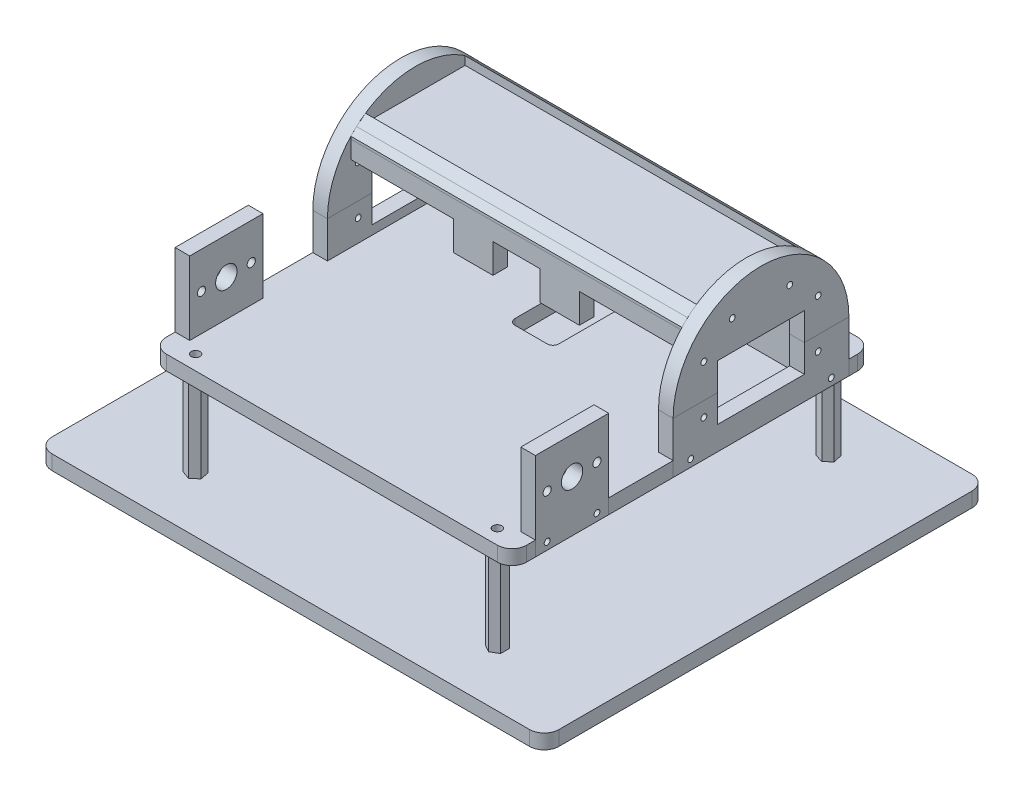
from build123d import *

# Parameters (mm, degrees)
RESSALTO_EXTRUS_O1_DEPTH        = 5
ESBO_O2_W                       = 5
ESBO_O2_H                       = 25
CORTE_EXTRUS_O1_DEPTH           = 5
RESSALTO_EXTRUS_O2_DEPTH        = 25
RESSALTO_EXTRUS_O2_DEPTH_BACK   = 5
ESBO_O4_W                       = 5
ESBO_O4_H                       = 25
RESSALTO_EXTRUS_O2_2_DEPTH      = 25
RESSALTO_EXTRUS_O2_2_DEPTH_BACK = 5
ESBO_O5_R                       = 1
ESBO_O5_R_2                     = 3.65
ESBO_O5_R_3                     = 1.4
CORTE_EXTRUS_O2_DEPTH           = 5
ESBO_O6_R                       = 1
ESBO_O6_R_2                     = 3.65
ESBO_O6_R_3                     = 1.4
CORTE_EXTRUS_O3_DEPTH           = 5
ESBO_O7_W                       = 5
ESBO_O7_H                       = 60
CORTE_EXTRUS_O4_DEPTH           = 5
RESSALTO_EXTRUS_O3_DEPTH        = 12.5
RESSALTO_EXTRUS_O3_DEPTH_BACK   = 5
ESBO_O8_W                       = 5
ESBO_O8_H                       = 60
RESSALTO_EXTRUS_O3_2_DEPTH      = 12.5
RESSALTO_EXTRUS_O3_2_DEPTH_BACK = 5
RESSALTO_EXTRUS_O4_DEPTH        = 5
RESSALTO_EXTRUS_O5_DEPTH        = 5
ESBO_O11_W                      = 29.591
ESBO_O11_H                      = 18.85
CORTE_EXTRUS_O5_DEPTH           = 5
ESBO_O17_W                      = 113
ESBO_O17_H                      = 5
RESSALTO_EXTRUS_O7_DEPTH        = 32
ESBO_O22_W                      = 113
ESBO_O22_H                      = 5
RESSALTO_EXTRUS_O10_DEPTH       = 32
ESBO_O23_W                      = 34
ESBO_O23_H                      = 5
RESSALTO_EXTRUS_O11_DEPTH       = 113
RESSALTO_EXTRUS_O12_DEPTH       = 113
RESSALTO_EXTRUS_O12_2_DEPTH     = 113
CORTE_EXTRUS_O7_DEPTH           = 39
CORTE_EXTRUS_O7_DEPTH_BACK      = 5
ESBO_O25_W                      = 35
ESBO_O25_H                      = 10
CORTE_EXTRUS_O8_DEPTH           = 39
CORTE_EXTRUS_O8_DEPTH_BACK      = 5
ESBO_O26_W                      = 35
ESBO_O26_H                      = 10
ESBO_O27_W                      = 29.6
ESBO_O27_H                      = 18.85
CORTE_EXTRUS_O9_DEPTH           = 5
ESBO_O28_R                      = 1
CORTE_EXTRUS_O10_DEPTH          = 5
ESBO_O29_R                      = 1
CORTE_EXTRUS_O11_DEPTH          = 5
ESBO_O31_R                      = 1.6255
CORTE_EXTRUS_O12_DEPTH          = 10
CORTE_EXTRUS_O13_DEPTH          = 5
ESBO_O33_W                      = 16
ESBO_O33_H                      = 10
CORTE_EXTRUS_O14_DEPTH          = 5
RESSALTO_EXTRUS_O13_DEPTH       = 30
RESSALTO_EXTRUS_O13_2_DEPTH     = 30
RESSALTO_EXTRUS_O13_3_DEPTH     = 30
RESSALTO_EXTRUS_O13_4_DEPTH     = 30
ESBO_O35_R                      = 1.5
RESSALTO_EXTRUS_O14_DEPTH       = 6
RESSALTO_EXTRUS_O14_2_DEPTH     = 6
RESSALTO_EXTRUS_O14_3_DEPTH     = 6
RESSALTO_EXTRUS_O14_4_DEPTH     = 6
ESBO_O36_R                      = 1.5
CORTE_EXTRUS_O15_DEPTH          = 10
RESSALTO_EXTRUS_O15_DEPTH       = 5
ESBO_O40_W                      = 113
ESBO_O40_H                      = 16
CORTE_EXTRUS_O16_DEPTH          = 5


with BuildPart() as part:
    # Esboço1 → Ressalto-extrusão1 (new body)
    with BuildSketch(Plane(origin=(0, 0, 0), x_dir=(1, 0, 0), z_dir=(0, 1, 0))):
        with BuildLine():
            Line((-20.688948469, 116.486662709), (92.311051531, 116.486662709))
            ThreePointArc((92.311051531, 116.486662709), (95.846585437, 115.022196615), (97.311051531, 111.486662709))
            Line((97.311051531, 111.486662709), (97.311051531, -1.513337291))
            ThreePointArc((97.311051531, -1.513337291), (95.846585437, -5.048871197), (92.311051531, -6.513337291))
            Line((92.311051531, -6.513337291), (-20.688948469, -6.513337291))
            ThreePointArc((-20.688948469, -6.513337291), (-24.224482375, -5.048871197), (-25.688948469, -1.513337291))
            Line((-25.688948469, -1.513337291), (-25.688948469, 111.486662709))
            ThreePointArc((-25.688948469, 111.486662709), (-24.224482375, 115.022196615), (-20.688948469, 116.486662709))
        make_face()
    extrude(amount=RESSALTO_EXTRUS_O1_DEPTH)

    # Esboço2 → Corte-extrusão1 (cut)
    with BuildSketch(Plane(origin=(0, 5, 0), x_dir=(1, 0, 0), z_dir=(0, 1, 0))):
        with Locations((94.811051531, 13.986662709)):
            Rectangle(ESBO_O2_W, ESBO_O2_H)
        with Locations((-23.188948469, 13.986662709)):
            Rectangle(ESBO_O2_W, ESBO_O2_H)
    extrude(amount=-CORTE_EXTRUS_O1_DEPTH, mode=Mode.SUBTRACT)

    # Esboço7 → Corte-extrusão4 (cut)
    with BuildSketch(Plane(origin=(0, 5, 0), x_dir=(1, 0, 0), z_dir=(0, 1, 0))):
        with Locations((94.811051531, 78.486662709)):
            Rectangle(ESBO_O7_W, ESBO_O7_H)
        with Locations((-23.188948469, 78.486662709)):
            Rectangle(ESBO_O7_W, ESBO_O7_H)
    extrude(amount=-CORTE_EXTRUS_O4_DEPTH, mode=Mode.SUBTRACT)

    # Esboço32 → Corte-extrusão13 (cut)
    with BuildSketch(Plane.XZ):
        with BuildLine():
            Line((30.311051531, -111.486662709), (41.311051531, -111.486662709))
            ThreePointArc((41.311051531, -111.486662709), (42.725265093, -110.900876271), (43.311051531, -109.486662709))
            Line((43.311051531, -109.486662709), (43.311051531, -63.486662709))
            ThreePointArc((43.311051531, -63.486662709), (42.725265093, -62.072449147), (41.311051531, -61.486662709))
            Line((41.311051531, -61.486662709), (30.311051531, -61.486662709))
            ThreePointArc((30.311051531, -61.486662709), (28.896837969, -62.072449147), (28.311051531, -63.486662709))
            Line((28.311051531, -63.486662709), (28.311051531, -109.486662709))
            ThreePointArc((28.311051531, -109.486662709), (28.896837969, -110.900876271), (30.311051531, -111.486662709))
        make_face()
    extrude(amount=-CORTE_EXTRUS_O13_DEPTH, mode=Mode.SUBTRACT)


with BuildPart() as body_2:
    # Esboço4 → Ressalto-extrusão2 (new, two sides: drawn at the far end of the back side and taken through both)
    with BuildSketch(Plane(origin=(0, 5, 0), x_dir=(1, 0, 0), z_dir=(0, 1, 0)).offset(-RESSALTO_EXTRUS_O2_DEPTH_BACK)):
        with Locations((94.811051531, 13.986662709)):
            Rectangle(ESBO_O4_W, ESBO_O4_H)
    extrude(amount=RESSALTO_EXTRUS_O2_DEPTH + RESSALTO_EXTRUS_O2_DEPTH_BACK)

    # Esboço5 → Corte-extrusão2 (cut)
    with BuildSketch(Plane(origin=(97.311051531, 0, 0), x_dir=(0, 0, -1), z_dir=(1, 0, 0))):
        with Locations((5.486662709, 2.5)):
            Circle(ESBO_O5_R)
        with Locations((22.486662709, 2.5)):
            Circle(ESBO_O5_R)
        with Locations((13.986662709, 17.5)):
            Circle(ESBO_O5_R_2)
        with Locations((5.486662709, 17.5)):
            Circle(ESBO_O5_R_3)
        with Locations((22.486662709, 17.5)):
            Circle(ESBO_O5_R_3)
    extrude(amount=-CORTE_EXTRUS_O2_DEPTH, mode=Mode.SUBTRACT)


with BuildPart() as body_3:
    # Esboço4 → Ressalto-extrus_o2 2 (new, two sides: drawn at the far end of the back side and taken through both)
    with BuildSketch(Plane(origin=(0, 5, 0), x_dir=(1, 0, 0), z_dir=(0, 1, 0)).offset(-RESSALTO_EXTRUS_O2_2_DEPTH_BACK)):
        with Locations((-23.188948469, 13.986662709)):
            Rectangle(ESBO_O4_W, ESBO_O4_H)
    extrude(amount=RESSALTO_EXTRUS_O2_2_DEPTH + RESSALTO_EXTRUS_O2_2_DEPTH_BACK)

    # Esboço6 → Corte-extrusão3 (cut)
    with BuildSketch(Plane.ZY.offset(25.688948469)):
        with Locations((-22.486662709, 2.5)):
            Circle(ESBO_O6_R)
        with Locations((-5.486662709, 2.5)):
            Circle(ESBO_O6_R)
        with Locations((-13.986662709, 17.5)):
            Circle(ESBO_O6_R_2)
        with Locations((-5.486662709, 17.5)):
            Circle(ESBO_O6_R_3)
        with Locations((-22.486662709, 17.5)):
            Circle(ESBO_O6_R_3)
    extrude(amount=-CORTE_EXTRUS_O3_DEPTH, mode=Mode.SUBTRACT)


with BuildPart() as body_4:
    # Esboço8 → Ressalto-extrusão3 (new, two sides: drawn at the far end of the back side and taken through both)
    with BuildSketch(Plane(origin=(0, 5, 0), x_dir=(1, 0, 0), z_dir=(0, 1, 0)).offset(-RESSALTO_EXTRUS_O3_DEPTH_BACK)):
        with Locations((94.811051531, 78.486662709)):
            Rectangle(ESBO_O8_W, ESBO_O8_H)
    extrude(amount=RESSALTO_EXTRUS_O3_DEPTH + RESSALTO_EXTRUS_O3_DEPTH_BACK)


with BuildPart() as body_5:
    # Esboço8 → Ressalto-extrus_o3 2 (new, two sides: drawn at the far end of the back side and taken through both)
    with BuildSketch(Plane(origin=(0, 5, 0), x_dir=(1, 0, 0), z_dir=(0, 1, 0)).offset(-RESSALTO_EXTRUS_O3_2_DEPTH_BACK)):
        with Locations((-23.188948469, 78.486662709)):
            Rectangle(ESBO_O8_W, ESBO_O8_H)
    extrude(amount=RESSALTO_EXTRUS_O3_2_DEPTH + RESSALTO_EXTRUS_O3_2_DEPTH_BACK)


with BuildPart() as body_6:
    # Esboço9 → Ressalto-extrusão4 (new body)
    with BuildSketch(Plane(origin=(97.311051531, 0, 0), x_dir=(0, 0, -1), z_dir=(1, 0, 0))):
        with BuildLine():
            Line((108.486662709, 17.5), (48.486662709, 17.5))
            ThreePointArc((48.486662709, 17.5), (78.486662709, 47.5), (108.486662709, 17.5))
        make_face()
    extrude(amount=-RESSALTO_EXTRUS_O4_DEPTH)


with BuildPart() as body_7:
    # Esboço10 → Ressalto-extrusão5 (new body)
    with BuildSketch(Plane.ZY.offset(25.688948469)):
        with BuildLine():
            Line((-48.486662709, 17.5), (-108.486662709, 17.5))
            ThreePointArc((-108.486662709, 17.5), (-78.486662709, 47.5), (-48.486662709, 17.5))
        make_face()
    extrude(amount=-RESSALTO_EXTRUS_O5_DEPTH)


with BuildPart() as corte_extrus_o5_tool:
    # Esboço11 → Corte-extrusão5 (new body)
    with BuildSketch(Plane.ZY.offset(25.688948469)):
        with Locations((-78.486662709, 17.525)):
            Rectangle(ESBO_O11_W, ESBO_O11_H)
    extrude(amount=-CORTE_EXTRUS_O5_DEPTH)


with BuildPart() as body_5_1:
    add(body_5.part)

    # Corte-extrusão5: cut by corte_extrus_o5_tool
    add(corte_extrus_o5_tool.part, mode=Mode.SUBTRACT)


with BuildPart() as body_7_1:
    add(body_7.part)

    # Corte-extrusão5: cut by corte_extrus_o5_tool
    add(corte_extrus_o5_tool.part, mode=Mode.SUBTRACT)


with BuildPart() as body_8:
    # Esboço17 → Ressalto-extrusão7 (new body)
    with BuildSketch(Plane(origin=(0, 5, 0), x_dir=(1, 0, 0), z_dir=(0, 1, 0))):
        with Locations((35.811051531, 58.986662709)):
            Rectangle(ESBO_O17_W, ESBO_O17_H)
    extrude(amount=RESSALTO_EXTRUS_O7_DEPTH)


with BuildPart() as body_9:
    # Esboço22 → Ressalto-extrusão10 (new body)
    with BuildSketch(Plane(origin=(0, 5, 0), x_dir=(1, 0, 0), z_dir=(0, 1, 0))):
        with Locations((35.811051531, 97.986662709)):
            Rectangle(ESBO_O22_W, ESBO_O22_H)
    extrude(amount=RESSALTO_EXTRUS_O10_DEPTH)


with BuildPart() as body_10:
    # Esboço23 → Ressalto-extrusão11 (new body)
    with BuildSketch(Plane.ZY.offset(-92.311051531)):
        with Locations((-78.486662709, 36.82)):
            Rectangle(ESBO_O23_W, ESBO_O23_H)
    extrude(amount=RESSALTO_EXTRUS_O11_DEPTH)


with BuildPart() as body_11:
    # Esboço24 → Ressalto-extrusão12 (new body)
    with BuildSketch(Plane.ZY.offset(-92.311051531)):
        Polygon((-100.486662709, 37), (-100.486662709, 37.866564726), (-98.561575635, 39.793449061), (-96.117316959, 41.772618951), (-95.486662709, 42.17326521), (-95.486662709, 37), align=None)
    extrude(amount=RESSALTO_EXTRUS_O12_DEPTH)


with BuildPart() as body_12:
    # Esboço24 → Ressalto-extrus_o12 2 (new body)
    with BuildSketch(Plane.ZY.offset(-92.311051531)):
        Polygon((-56.486662709, 37), (-61.486662709, 37), (-61.486662709, 42.17326521), (-58.411749783, 39.793449061), (-56.486662709, 37.868361986), align=None)
    extrude(amount=RESSALTO_EXTRUS_O12_2_DEPTH)


with BuildPart() as corte_extrus_o7_tool:
    # Esboço25 → Corte-extrusão7 (new, two sides: drawn at the far end of the back side and taken through both)
    with BuildSketch(Plane(origin=(0, 0, -61.486662709), x_dir=(-1, 0, 0), z_dir=(0, 0, -1)).offset(-CORTE_EXTRUS_O7_DEPTH_BACK)):
        with Locations((3.188948469, 26)):
            Rectangle(ESBO_O25_W, ESBO_O25_H)
    extrude(amount=CORTE_EXTRUS_O7_DEPTH + CORTE_EXTRUS_O7_DEPTH_BACK)


with BuildPart() as body_8_1:
    add(body_8.part)

    # Corte-extrusão7: cut by corte_extrus_o7_tool
    add(corte_extrus_o7_tool.part, mode=Mode.SUBTRACT)


with BuildPart() as body_9_1:
    add(body_9.part)

    # Corte-extrusão7: cut by corte_extrus_o7_tool
    add(corte_extrus_o7_tool.part, mode=Mode.SUBTRACT)


with BuildPart() as corte_extrus_o8_tool:
    # Esboço26 → Corte-extrusão8 (new, two sides: drawn at the far end of the back side and taken through both)
    with BuildSketch(Plane(origin=(0, 0, -61.486662709), x_dir=(-1, 0, 0), z_dir=(0, 0, -1)).offset(-CORTE_EXTRUS_O8_DEPTH_BACK)):
        with Locations((-74.811051531, 26)):
            Rectangle(ESBO_O26_W, ESBO_O26_H)
    extrude(amount=CORTE_EXTRUS_O8_DEPTH + CORTE_EXTRUS_O8_DEPTH_BACK)


with BuildPart() as body_8_2:
    add(body_8_1.part)

    # Corte-extrusão8: cut by corte_extrus_o8_tool
    add(corte_extrus_o8_tool.part, mode=Mode.SUBTRACT)

    # Esboço33 → Corte-extrusão14 (cut)
    with BuildSketch(Plane.XY.offset(-56.486662709)):
        with Locations((35.811051531, 26)):
            Rectangle(ESBO_O33_W, ESBO_O33_H)
    extrude(amount=-CORTE_EXTRUS_O14_DEPTH, mode=Mode.SUBTRACT)

    # Esboço40 → Corte-extrusão16 (cut)
    with BuildSketch(Plane.XY.offset(-56.486662709)):
        with Locations((35.811051531, 13)):
            Rectangle(ESBO_O40_W, ESBO_O40_H)
    extrude(amount=-CORTE_EXTRUS_O16_DEPTH, mode=Mode.SUBTRACT)


with BuildPart() as body_9_2:
    add(body_9_1.part)

    # Corte-extrusão8: cut by corte_extrus_o8_tool
    add(corte_extrus_o8_tool.part, mode=Mode.SUBTRACT)

    # Esboço31 → Corte-extrusão12 (cut)
    with BuildSketch(Plane(origin=(0, 0, -100.486662709), x_dir=(-1, 0, 0), z_dir=(0, 0, -1))):
        with Locations((-17.141051531, 13)):
            Circle(ESBO_O31_R)
        with Locations((-54.481051531, 13)):
            Circle(ESBO_O31_R)
    extrude(amount=-CORTE_EXTRUS_O12_DEPTH, mode=Mode.SUBTRACT)


with BuildPart() as corte_extrus_o9_tool:
    # Esboço27 → Corte-extrusão9 (new body)
    with BuildSketch(Plane(origin=(97.311051531, 0, 0), x_dir=(0, 0, -1), z_dir=(1, 0, 0))):
        with Locations((78.486662709, 17.525)):
            Rectangle(ESBO_O27_W, ESBO_O27_H)
    extrude(amount=-CORTE_EXTRUS_O9_DEPTH)


with BuildPart() as body_4_1:
    add(body_4.part)

    # Corte-extrusão9: cut by corte_extrus_o9_tool
    add(corte_extrus_o9_tool.part, mode=Mode.SUBTRACT)


with BuildPart() as body_6_1:
    add(body_6.part)

    # Corte-extrusão9: cut by corte_extrus_o9_tool
    add(corte_extrus_o9_tool.part, mode=Mode.SUBTRACT)


with BuildPart() as corte_extrus_o10_tool:
    # Esboço28 → Corte-extrusão10 (new body)
    with BuildSketch(Plane.ZY.offset(25.688948469)):
        with Locations((-97.986662709, 12.5)):
            Circle(ESBO_O28_R)
        with Locations((-97.986662709, 29)):
            Circle(ESBO_O28_R)
        with Locations((-58.986662709, 29)):
            Circle(ESBO_O28_R)
        with Locations((-58.986662709, 12.5)):
            Circle(ESBO_O28_R)
        with Locations((-88.282162709, 37)):
            Circle(ESBO_O28_R)
        with Locations((-68.691162709, 37)):
            Circle(ESBO_O28_R)
        with Locations((-54.486662709, 2.5)):
            Circle(ESBO_O28_R)
        with Locations((-102.486662709, 2.5)):
            Circle(ESBO_O28_R)
    extrude(amount=-CORTE_EXTRUS_O10_DEPTH)


with BuildPart() as body_5_2:
    add(body_5_1.part)

    # Corte-extrusão10: cut by corte_extrus_o10_tool
    add(corte_extrus_o10_tool.part, mode=Mode.SUBTRACT)


with BuildPart() as body_7_2:
    add(body_7_1.part)

    # Corte-extrusão10: cut by corte_extrus_o10_tool
    add(corte_extrus_o10_tool.part, mode=Mode.SUBTRACT)


with BuildPart() as corte_extrus_o11_tool:
    # Esboço29 → Corte-extrusão11 (new body)
    with BuildSketch(Plane(origin=(97.311051531, 0, 0), x_dir=(0, 0, -1), z_dir=(1, 0, 0))):
        with Locations(Location((54.486662709, 2.5, 0), (0, 0, 180))):
            Circle(ESBO_O29_R)
        with Locations(Location((102.486662709, 2.5, 0), (0, 0, 180))):
            Circle(ESBO_O29_R)
        with Locations(Location((58.986662709, 12.5, 0), (0, 0, 180))):
            Circle(ESBO_O29_R)
        with Locations(Location((58.986662709, 29, 0), (0, 0, 180))):
            Circle(ESBO_O29_R)
        with Locations((68.686662709, 37)):
            Circle(ESBO_O29_R)
        with Locations((88.286662709, 37)):
            Circle(ESBO_O29_R)
        with Locations(Location((97.986662709, 29, 0), (0, 0, 180))):
            Circle(ESBO_O29_R)
        with Locations(Location((97.986662709, 12.5, 0), (0, 0, 180))):
            Circle(ESBO_O29_R)
    extrude(amount=-CORTE_EXTRUS_O11_DEPTH)


with BuildPart() as body_4_2:
    add(body_4_1.part)

    # Corte-extrusão11: cut by corte_extrus_o11_tool
    add(corte_extrus_o11_tool.part, mode=Mode.SUBTRACT)


with BuildPart() as body_6_2:
    add(body_6_1.part)

    # Corte-extrusão11: cut by corte_extrus_o11_tool
    add(corte_extrus_o11_tool.part, mode=Mode.SUBTRACT)


with BuildPart() as body_13:
    # Esboço34 → Ressalto-extrusão13 (new body)
    with BuildSketch(Plane.XZ):
        Polygon((87.311051531, 4.513337291), (84.71297532, 3.013337291), (84.71297532, 0.013337291), (87.311051531, -1.486662709), (89.909127742, 0.013337291), (89.909127742, 3.013337291), align=None)
    extrude(amount=RESSALTO_EXTRUS_O13_DEPTH)


with BuildPart() as body_14:
    # Esboço34 → Ressalto-extrus_o13 2 (new body)
    with BuildSketch(Plane.XZ):
        Polygon((-13.420554992, -0.449923017), (-12.85451843, 2.496193514), (-15.122911907, 4.459453821), (-17.957341945, 3.476597599), (-18.523378508, 0.530481068), (-16.254985031, -1.432779239), align=None)
    extrude(amount=RESSALTO_EXTRUS_O13_2_DEPTH)


with BuildPart() as body_15:
    # Esboço34 → Ressalto-extrus_o13 3 (new body)
    with BuildSketch(Plane.XZ):
        Polygon((87.969999913, -108.559926125), (85.10589749, -109.452628379), (84.446949109, -112.379364963), (86.65210315, -114.413399293), (89.516205572, -113.520697039), (90.175153954, -110.593960455), align=None)
    extrude(amount=RESSALTO_EXTRUS_O13_3_DEPTH)


with BuildPart() as body_16:
    # Esboço34 → Ressalto-extrus_o13 4 (new body)
    with BuildSketch(Plane.XZ):
        Polygon((-18.480554249, -110.388055788), (-18.036172861, -113.354960772), (-15.244567081, -114.453567693), (-12.897342688, -112.58526963), (-13.341724077, -109.618364646), (-16.133329857, -108.519757725), align=None)
    extrude(amount=RESSALTO_EXTRUS_O13_4_DEPTH)


with BuildPart() as body_17:
    # Esboço35 → Ressalto-extrusão14 (new body)
    with BuildSketch(Plane.XZ.offset(30)):
        with Locations(Location((87.278117348, -111.624182303, 0), (0, 0, 270))):
            Circle(ESBO_O35_R)
    extrude(amount=RESSALTO_EXTRUS_O14_DEPTH)


with BuildPart() as body_18:
    # Esboço35 → Ressalto-extrus_o14 2 (new body)
    with BuildSketch(Plane.XZ.offset(30)):
        with Locations(Location((-15.705941855, -111.624182303, 0), (0, 0, 270))):
            Circle(ESBO_O35_R)
    extrude(amount=RESSALTO_EXTRUS_O14_2_DEPTH)


with BuildPart() as body_19:
    # Esboço35 → Ressalto-extrus_o14 3 (new body)
    with BuildSketch(Plane.XZ.offset(30)):
        with Locations(Location((-15.705941855, 1.457424581, 0), (0, 0, 270))):
            Circle(ESBO_O35_R)
    extrude(amount=RESSALTO_EXTRUS_O14_3_DEPTH)


with BuildPart() as body_20:
    # Esboço35 → Ressalto-extrus_o14 4 (new body)
    with BuildSketch(Plane.XZ.offset(30)):
        with Locations(Location((87.278117348, 1.457424581, 0), (0, 0, 270))):
            Circle(ESBO_O35_R)
    extrude(amount=RESSALTO_EXTRUS_O14_4_DEPTH)


with BuildPart() as corte_extrus_o15_tool:
    # Esboço36 → Corte-extrusão15 (new body)
    with BuildSketch(Plane(origin=(0, 5, 0), x_dir=(1, 0, 0), z_dir=(0, 1, 0))):
        with Locations(Location((87.311051531, -1.513337291, 0), (0, 0, 270))):
            Circle(ESBO_O36_R)
        with Locations(Location((-15.688948469, -1.513337291, 0), (0, 0, 270))):
            Circle(ESBO_O36_R)
        with Locations(Location((-15.688948469, 111.486662709, 0), (0, 0, 270))):
            Circle(ESBO_O36_R)
        with Locations(Location((87.311051531, 111.486662709, 0), (0, 0, 270))):
            Circle(ESBO_O36_R)
    extrude(amount=-CORTE_EXTRUS_O15_DEPTH)


with BuildPart() as part_1:
    add(part.part)

    # Corte-extrusão15: cut by corte_extrus_o15_tool
    add(corte_extrus_o15_tool.part, mode=Mode.SUBTRACT)


with BuildPart() as body_13_1:
    add(body_13.part)

    # Corte-extrusão15: cut by corte_extrus_o15_tool
    add(corte_extrus_o15_tool.part, mode=Mode.SUBTRACT)


with BuildPart() as body_14_1:
    add(body_14.part)

    # Corte-extrusão15: cut by corte_extrus_o15_tool
    add(corte_extrus_o15_tool.part, mode=Mode.SUBTRACT)


with BuildPart() as body_15_1:
    add(body_15.part)

    # Corte-extrusão15: cut by corte_extrus_o15_tool
    add(corte_extrus_o15_tool.part, mode=Mode.SUBTRACT)


with BuildPart() as body_16_1:
    add(body_16.part)

    # Corte-extrusão15: cut by corte_extrus_o15_tool
    add(corte_extrus_o15_tool.part, mode=Mode.SUBTRACT)


with BuildPart() as body_21:
    # Esboço38 → Ressalto-extrusão15 (new body)
    with BuildSketch(Plane.XZ.offset(30)):
        with BuildLine():
            Line((-45.688948469, 20.513337291), (117.311051531, 20.513337291))
            ThreePointArc((117.311051531, 20.513337291), (120.846585437, 19.048871197), (122.311051531, 15.513337291))
            Line((122.311051531, 15.513337291), (122.311051531, -125.486662709))
            ThreePointArc((122.311051531, -125.486662709), (120.846585437, -129.022196615), (117.311051531, -130.486662709))
            Line((117.311051531, -130.486662709), (-45.688948469, -130.486662709))
            ThreePointArc((-45.688948469, -130.486662709), (-49.224482375, -129.022196615), (-50.688948469, -125.486662709))
            Line((-50.688948469, -125.486662709), (-50.688948469, 15.513337291))
            ThreePointArc((-50.688948469, 15.513337291), (-49.224482375, 19.048871197), (-45.688948469, 20.513337291))
        make_face()
    extrude(amount=RESSALTO_EXTRUS_O15_DEPTH)


solid = Compound([body_2.part, body_3.part, body_10.part, body_11.part, body_12.part, body_8_2.part, body_9_2.part, body_5_2.part, body_7_2.part, body_4_2.part, body_6_2.part, body_17.part, body_18.part, body_19.part, body_20.part, part_1.part, body_13_1.part, body_14_1.part, body_15_1.part, body_16_1.part, body_21.part])
